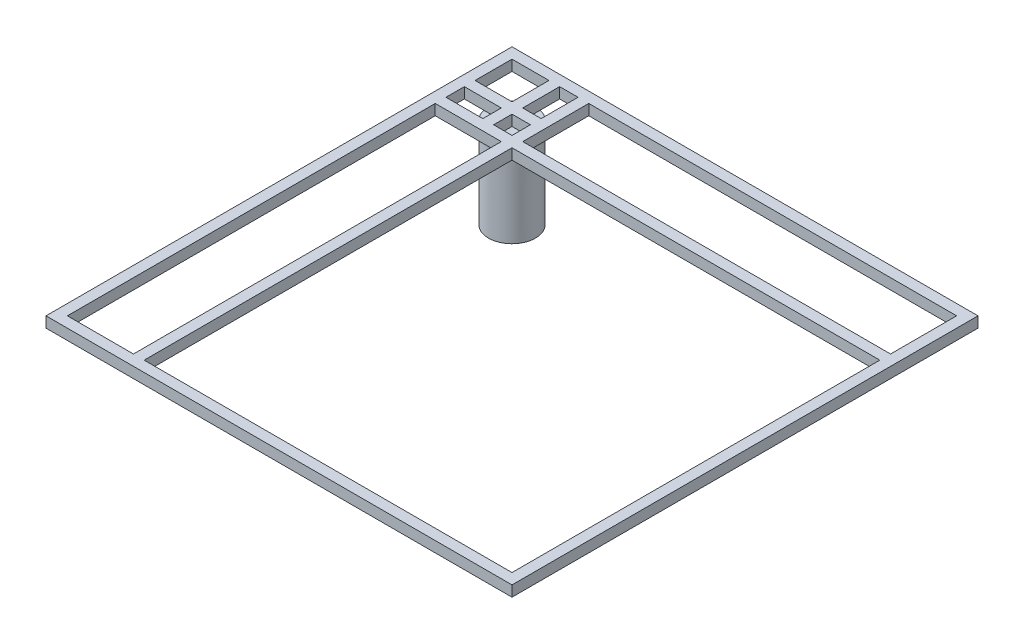
from build123d import *

# Parameters (mm, degrees)
SKETCH1_W           = 567.538044716
SKETCH1_H           = 567.538044716
SKETCH1_W_2         = 80.467
SKETCH1_H_2         = 448.005044716
SKETCH1_W_3         = 45
SKETCH1_H_3         = 45
SKETCH1_W_4         = 448.005044716
SKETCH1_W_5         = 22.445
SKETCH1_H_4         = 22.445
SKETCH1_H_5         = 80.467
BOSS_EXTRUDE1_DEPTH = 13.022
SKETCH2_R           = 28.6
BOSS_EXTRUDE2_DEPTH = 110


with BuildPart() as part:
    # Sketch1 → Boss-Extrude1 (new body)
    with BuildSketch(Plane(origin=(0, 0, 0), x_dir=(1, 0, 0), z_dir=(0, 1, 0))):
        with Locations((283.769022358, 283.769022358)):
            Rectangle(SKETCH1_W, SKETCH1_H)
        with Locations((53.2555, 237.024522358)):
            Rectangle(SKETCH1_W_2, SKETCH1_H_2, mode=Mode.SUBTRACT)
        with Locations((35.522, 532.016044716)):
            Rectangle(SKETCH1_W_3, SKETCH1_H_3, mode=Mode.SUBTRACT)
        with Locations((330.513522358, 237.024522358)):
            Rectangle(SKETCH1_W_4, SKETCH1_H_2, mode=Mode.SUBTRACT)
        with Locations((82.2665, 532.016044716)):
            Rectangle(SKETCH1_W_5, SKETCH1_H_3, mode=Mode.SUBTRACT)
        with Locations((35.522, 485.271544716)):
            Rectangle(SKETCH1_W_3, SKETCH1_H_4, mode=Mode.SUBTRACT)
        with Locations((330.513522358, 514.282544716)):
            Rectangle(SKETCH1_W_4, SKETCH1_H_5, mode=Mode.SUBTRACT)
        with Locations((82.2665, 485.271544716)):
            Rectangle(SKETCH1_W_5, SKETCH1_H_4, mode=Mode.SUBTRACT)
    extrude(amount=BOSS_EXTRUDE1_DEPTH)

    # Sketch2 → Boss-Extrude2 (add)
    with BuildSketch(Plane.XZ):
        with Locations(Location((64.533, -503.005044716, 0), (0, 0, 103.159188844))):
            Circle(SKETCH2_R)
    extrude(amount=BOSS_EXTRUDE2_DEPTH)


solid = part.part
